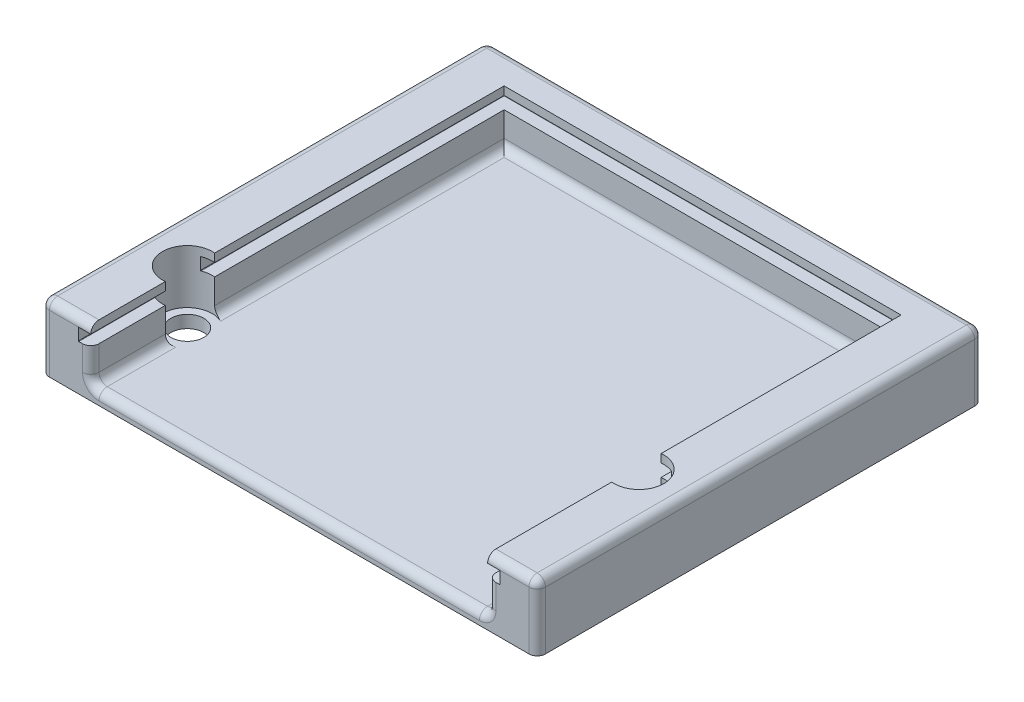
from build123d import *

# Parameters (mm, degrees)
BOSS_EXTRUDE1_DEPTH = 1.5
BOSS_EXTRUDE4_DEPTH = 8
SKETCH6_W           = 50
SKETCH6_H           = 1.5
CUT_EXTRUDE1_DEPTH  = 1.5
SKETCH10_W          = 50
SKETCH10_H          = 1.5
CUT_EXTRUDE2_DEPTH  = 1.5
SKETCH11_W          = 51
SKETCH11_H          = 1.5
CUT_EXTRUDE3_DEPTH  = 1.5
FILLET1_R           = 1
FILLET2_R           = 0.05


with BuildPart() as part:
    # Sketch2 → Boss-Extrude1 (new body)
    with BuildSketch(Plane(origin=(0, 0, 0), x_dir=(1, 0, 0), z_dir=(0, 1, 0))):
        with BuildLine():
            Line((6, 9.016650219), (6, 0))
            Line((6, 0), (54, 0))
            Line((54, 0), (54, 15.016650219))
            ThreePointArc((54, 15.016650219), (51.315632832, 18), (54, 20.983349781))
            Line((54, 20.983349781), (54, 50))
            Line((54, 50), (6, 50))
            Line((6, 50), (6, 14.983349781))
            ThreePointArc((6, 14.983349781), (7.914490315, 14.00662671), (8.684367168, 12))
            ThreePointArc((8.684367168, 12), (7.914490315, 9.99337329), (6, 9.016650219))
        make_face()
        with BuildLine():
            ThreePointArc((54, 20.983349781), (51.315632832, 18), (54, 15.016650219))
            Line((54, 15.016650219), (54, 16.02506306))
            ThreePointArc((54, 16.02506306), (52.315632832, 18), (54, 19.97493694))
            Line((54, 19.97493694), (54, 20.983349781))
        make_face()
        with BuildLine():
            Line((54, 16.02506306), (54, 15.016650219))
            ThreePointArc((54, 15.016650219), (56.322259541, 15.769876854), (57.315632832, 18))
            ThreePointArc((57.315632832, 18), (56.322259541, 20.230123146), (54, 20.983349781))
            Line((54, 20.983349781), (54, 19.97493694))
            ThreePointArc((54, 19.97493694), (55.61346455, 19.521720353), (56.315632832, 18))
            ThreePointArc((56.315632832, 18), (55.61346455, 16.478279647), (54, 16.02506306))
        make_face()
        with BuildLine():
            ThreePointArc((6, 14.983349781), (2.684367168, 12), (6, 9.016650219))
            Line((6, 9.016650219), (6, 10.02506306))
            ThreePointArc((6, 10.02506306), (3.684367168, 12), (6, 13.97493694))
            Line((6, 13.97493694), (6, 14.983349781))
        make_face()
        with BuildLine():
            Line((6, 10.02506306), (6, 9.016650219))
            ThreePointArc((6, 9.016650219), (7.914490315, 9.99337329), (8.684367168, 12))
            ThreePointArc((8.684367168, 12), (7.914490315, 14.00662671), (6, 14.983349781))
            Line((6, 14.983349781), (6, 13.97493694))
            ThreePointArc((6, 13.97493694), (7.206087521, 13.297831718), (7.684367168, 12))
            ThreePointArc((7.684367168, 12), (7.206087521, 10.702168282), (6, 10.02506306))
        make_face()
    extrude(amount=BOSS_EXTRUDE1_DEPTH)

    # Sketch2<7> → Boss-Extrude4 (add)
    with BuildSketch(Plane(origin=(0, 0, 0), x_dir=(1, 0, 0), z_dir=(0, 1, 0))):
        with BuildLine():
            Line((0, 0), (6, 0))
            Line((6, 0), (6, 9.016650219))
            ThreePointArc((6, 9.016650219), (2.684367168, 12), (6, 14.983349781))
            Line((6, 14.983349781), (6, 50))
            Line((6, 50), (54, 50))
            Line((54, 50), (54, 20.983349781))
            ThreePointArc((54, 20.983349781), (57.315632832, 18), (54, 15.016650219))
            Line((54, 15.016650219), (54, 0))
            Line((54, 0), (60, 0))
            Line((60, 0), (60, 53.896997513))
            Line((60, 53.896997513), (0, 53.896997513))
            Line((0, 53.896997513), (0, 0))
        make_face()
    extrude(amount=BOSS_EXTRUDE4_DEPTH)

    # Sketch6 → Cut-Extrude1 (cut)
    with BuildSketch(Plane(origin=(6, 0, 0), x_dir=(0, 0, -1), z_dir=(1, 0, 0))):
        with Locations((25, 6.25)):
            Rectangle(SKETCH6_W, SKETCH6_H)
    extrude(amount=-CUT_EXTRUDE1_DEPTH, mode=Mode.SUBTRACT)

    # Sketch10 → Cut-Extrude2 (cut)
    with BuildSketch(Plane.ZY.offset(-54)):
        with Locations((-25, 6.25)):
            Rectangle(SKETCH10_W, SKETCH10_H)
    extrude(amount=-CUT_EXTRUDE2_DEPTH, mode=Mode.SUBTRACT)

    # Sketch11 → Cut-Extrude3 (cut)
    with BuildSketch(Plane.XY.offset(-50)):
        with Locations((30, 6.25)):
            Rectangle(SKETCH11_W, SKETCH11_H)
    extrude(amount=-CUT_EXTRUDE3_DEPTH, mode=Mode.SUBTRACT)

    # Fillet1
    fillet1_edges = [part.edges().sort_by_distance(p)[0] for p in [
        (6, 1.5, -4.50832511),
        (6, 1.5, -32.49167489),
        (30, 1.5, -50),
        (54, 1.5, -35.49167489),
        (54, 1.5, -7.50832511),
        (30, 1.5, 0),
        (54, 3.5, 0),
        (6, 3.5, 0),
        (60, 4, -53.896997513),
        (0, 4, -53.896997513),
        (30, 8, -53.896997513),
        (0, 4, 0),
        (60, 4, 0),
        (60, 8, -26.948498756),
        (57, 8, 0),
        (3, 8, 0),
        (0, 8, -26.948498756),
    ]]
    fillet(fillet1_edges, radius=FILLET1_R)

    # Fillet2
    fillet2_edges = [part.edges().sort_by_distance(p)[0] for p in [
        (55.5, 7, -36.128157684),
        (55.5, 5.5, -7.621842316),
        (55.5, 7, -7.621842316),
        (55.5, 5.5, -36.128157684),
        (30, 7, -51.5),
        (30, 5.5, -51.5),
        (4.5, 7, -33.128157684),
        (4.5, 5.5, -4.621842316),
        (4.5, 7, -4.621842316),
        (4.5, 5.5, -33.128157684),
    ]]
    fillet(fillet2_edges, radius=FILLET2_R)


solid = part.part
